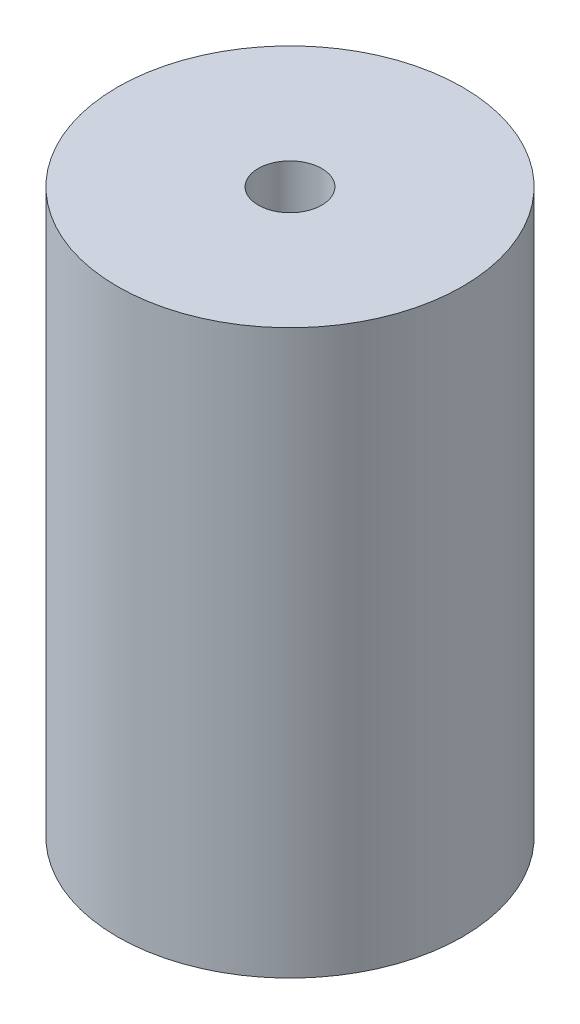
from build123d import *

# Parameters (mm, degrees)
SKETCH1_R           = 19
SKETCH1_R_2         = 3.5
BOSS_EXTRUDE1_DEPTH = 62


with BuildPart() as part:
    # Sketch1 → Boss-Extrude1 (new body)
    with BuildSketch(Plane(origin=(0, 0, 0), x_dir=(1, 0, 0), z_dir=(0, 1, 0))):
        with Locations(Location((0, 0, 0), (0, 0, 270))):
            Circle(SKETCH1_R)
        with Locations(Location((0, 0, 0), (0, 0, 270))):
            Circle(SKETCH1_R_2, mode=Mode.SUBTRACT)
    extrude(amount=BOSS_EXTRUDE1_DEPTH)


solid = part.part
